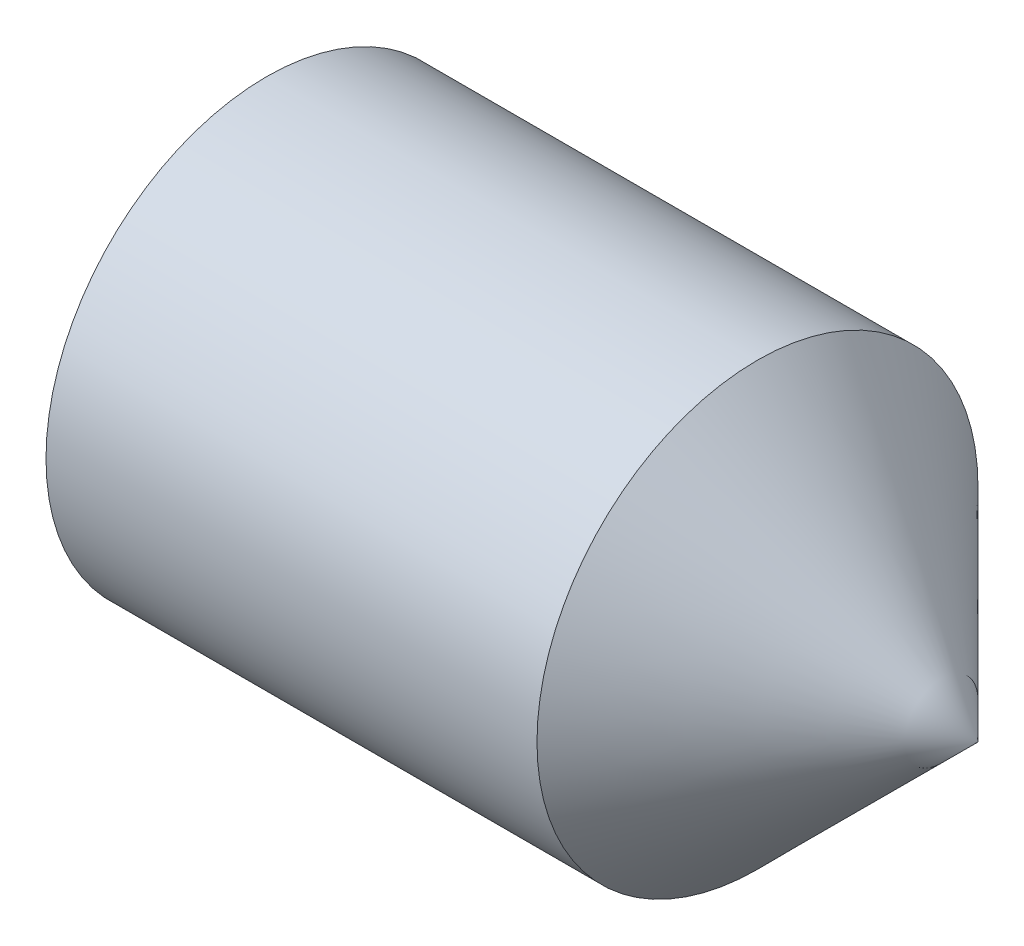
from build123d import *

# Parameters (mm, degrees)
HEX_2_DEPTH = 3.5


with BuildPart() as part:
    # BodySke → BaseBody (revolve)
    with BuildSketch(Plane.XY, mode=Mode.PRIVATE) as basebody_sk:
        Polygon((0, 0), (0, 2.4455), (0.320140724, 3), (7, 3), (10, 0), align=None)
    revolve(basebody_sk.sketch.rotate(Axis((-12.7, 0, 0), (1, 0, 0)), 90), axis=Axis((-12.7, 0, 0), (1, 0, 0)))

    # Sketch2 → Hex 2 (cut)
    with BuildSketch(Plane.ZY):
        Polygon((0.866025404, 1.5), (-0.866025404, 1.5), (-1.732050808, 0), (-0.866025404, -1.5), (0.866025404, -1.5), (1.732050808, 0), align=None)
    extrude(amount=-HEX_2_DEPTH, mode=Mode.SUBTRACT)


solid = part.part
